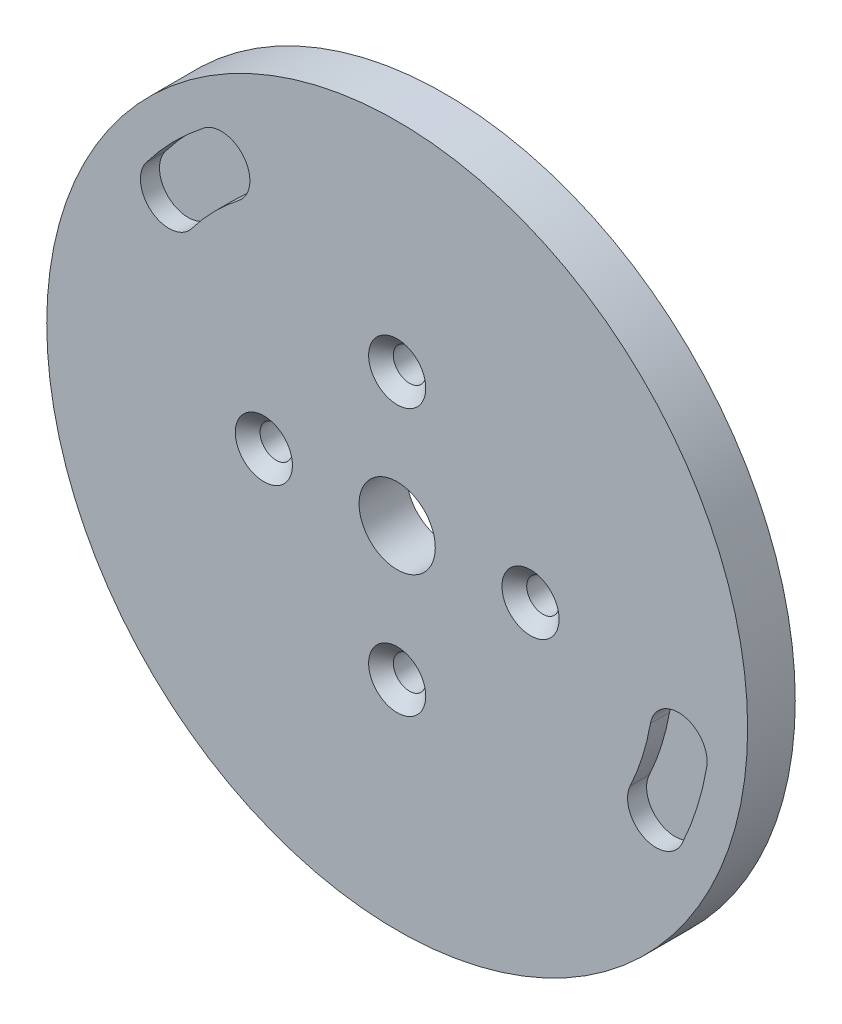
from build123d import *

# Parameters (mm, degrees)
SKETCH1_R                                           = 36.8
BOSS_EXTRUDE1_DEPTH                                 = 5
CUT_EXTRUDE1_REACH                                  = 54.283
SKETCH2_R                                           = 4
CUT_EXTRUDE2_DEPTH                                  = 2
CUT_EXTRUDE3_DEPTH                                  = 2
CSK_FOR_M3_FLAT_COUNTERSUNK_HEAD_SCREW1_D           = 3.4
CSK_FOR_M3_FLAT_COUNTERSUNK_HEAD_SCREW1_DEPTH       = 9
CSK_FOR_M3_FLAT_COUNTERSUNK_HEAD_SCREW1_CSINK_D     = 6
CSK_FOR_M3_FLAT_COUNTERSUNK_HEAD_SCREW1_CSINK_ANGLE = 90
CSK_FOR_M3_FLAT_COUNTERSUNK_HEAD_SCREW1_TIP         = 1.021463052


with BuildPart() as part:
    # Sketch1 → Boss-Extrude1 (new body)
    with BuildSketch(Plane.XY):
        Circle(SKETCH1_R)
    extrude(amount=BOSS_EXTRUDE1_DEPTH)

    # Sketch2 → Cut-Extrude1 (cut, up to next)
    with BuildSketch(Plane.XY.offset(5), mode=Mode.PRIVATE) as cut_extrude1_sk1:
        Circle(SKETCH2_R)
    cut_extrude1_tool1 = extrude(cut_extrude1_sk1.sketch, amount=-CUT_EXTRUDE1_REACH, mode=Mode.PRIVATE) & part.part
    add(cut_extrude1_tool1.solids().sort_by_distance((0, 0, 5))[0], mode=Mode.SUBTRACT)

    # Sketch3 → Cut-Extrude2 (cut)
    with BuildSketch(Plane.XY.offset(5)):
        with BuildLine():
            ThreePointArc((24.47031025, -11.410693067), (25.75035767, -8.119056587), (26.589809331, -4.688500797))
            ThreePointArc((26.589809331, -4.688500797), (30.065177123, -2.255022071), (32.498655849, -5.730389863))
            ThreePointArc((32.498655849, -5.730389863), (31.472659375, -9.923291384), (29.908156972, -13.946402637))
            ThreePointArc((29.908156972, -13.946402637), (25.921378826, -15.397471213), (24.47031025, -11.410693067))
        make_face()
    extrude(amount=-CUT_EXTRUDE2_DEPTH, mode=Mode.SUBTRACT)

    # Sketch4 → Cut-Extrude3 (cut)
    with BuildSketch(Plane.XY.offset(5)):
        with BuildLine():
            ThreePointArc((-20.316828686, 26.004354869), (-23.537264822, 23.130005722), (-26.354971832, 19.859895764))
            ThreePointArc((-26.354971832, 19.859895764), (-25.764510371, 15.658544164), (-21.563158771, 16.249005625))
            ThreePointArc((-21.563158771, 16.249005625), (-19.257762127, 18.924550136), (-16.622859834, 21.276290347))
            ThreePointArc((-16.622859834, 21.276290347), (-16.105811999, 25.487307034), (-20.316828686, 26.004354869))
        make_face()
    extrude(amount=-CUT_EXTRUDE3_DEPTH, mode=Mode.SUBTRACT)

    # CSK for M3 Flat Countersunk Head Screw1
    with Locations(Plane.XY.offset(5)):
        with Locations((0, 14), (14, 0), (0, -14), (-14, 0)):
            CounterSinkHole(CSK_FOR_M3_FLAT_COUNTERSUNK_HEAD_SCREW1_D / 2, CSK_FOR_M3_FLAT_COUNTERSUNK_HEAD_SCREW1_CSINK_D / 2, depth=CSK_FOR_M3_FLAT_COUNTERSUNK_HEAD_SCREW1_DEPTH, counter_sink_angle=CSK_FOR_M3_FLAT_COUNTERSUNK_HEAD_SCREW1_CSINK_ANGLE)
            with Locations((0, 0, -(CSK_FOR_M3_FLAT_COUNTERSUNK_HEAD_SCREW1_DEPTH + CSK_FOR_M3_FLAT_COUNTERSUNK_HEAD_SCREW1_TIP / 2))):  # 118° drill point
                Cone(0, CSK_FOR_M3_FLAT_COUNTERSUNK_HEAD_SCREW1_D / 2, CSK_FOR_M3_FLAT_COUNTERSUNK_HEAD_SCREW1_TIP, mode=Mode.SUBTRACT)


solid = part.part
